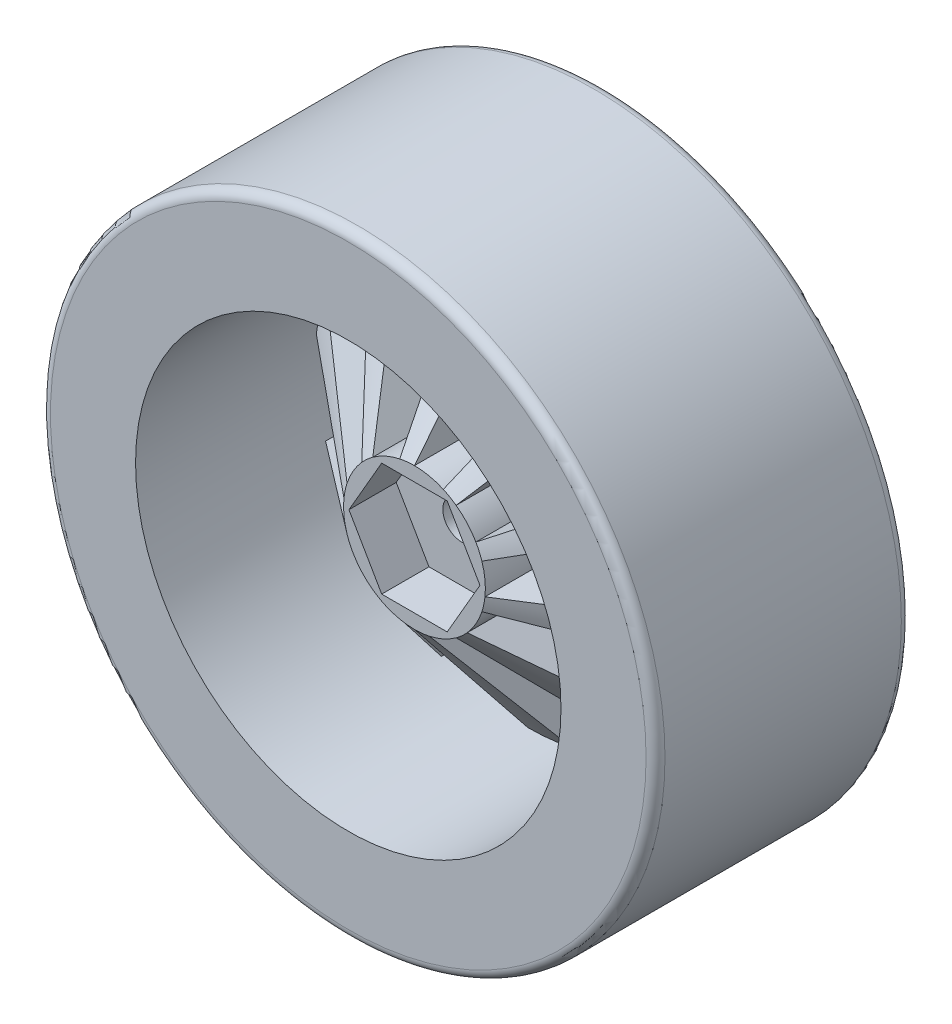
from build123d import *

# Parameters (mm, degrees)
SKETCH_1_R               = 7.5
EXTRUDE_1_DEPTH          = 5
EXTRUDE_START            = -3
SKETCH_2_R               = 7.5
SKETCH_2_R_2             = 2
EXTRUDE_2_DEPTH          = 3
EXTRUDE_3_DEPTH          = 12
EXTRUDE_3_DEPTH_BACK     = 15
SKETCH_3_R               = 32.5
SKETCH_3_R_2             = 22.5
REVOLVE_1_ANGLE          = 12
PATTERN_CIRCULAR_1_COUNT = 10
SKETCH_5_R               = 4.5
CUT_EXTRUDE_1_DEPTH      = 2
FILLET_1_R               = 1


with BuildPart() as part:
    # 草图1 → 凸台-拉伸1 (new body)
    with BuildSketch(Plane.XY):
        Circle(SKETCH_1_R)
        Polygon((-6.92820323, 0), (-3.464101615, -6), (3.464101615, -6), (6.92820323, 0), (3.464101615, 6), (-3.464101615, 6), align=None, mode=Mode.SUBTRACT)
    extrude(amount=EXTRUDE_1_DEPTH)

    # 草图2 → 凸台-拉伸2 (add)
    with BuildSketch(Plane.XY.offset(EXTRUDE_START)):
        Circle(SKETCH_2_R)
        Circle(SKETCH_2_R_2, mode=Mode.SUBTRACT)
    extrude(amount=EXTRUDE_2_DEPTH)



with BuildPart() as body_2:
    # 草图3 → 凸台-拉伸3 (new, two sides: drawn at the far end of the back side and taken through both)
    with BuildSketch(Plane.XY.offset(-EXTRUDE_3_DEPTH_BACK)):
        Circle(SKETCH_3_R)
        Circle(SKETCH_3_R_2, mode=Mode.SUBTRACT)
    extrude(amount=EXTRUDE_3_DEPTH + EXTRUDE_3_DEPTH_BACK)


with BuildPart() as part_1:
    add(part.part)

    add(body_2.part)  # 旋转1 merges body 2
    # 草图4 → 旋转1 (revolve)
    with BuildSketch(Plane(origin=(0, 0, 0), x_dir=(0, 0, -1), z_dir=(1, 0, 0))):
        Polygon((-5, 7.5), (3, 7.5), (15, 22.5), (7, 22.5), align=None)
    revolve_1 = revolve(axis=Axis((0, 0, -16.35), (0, 0, 1)), revolution_arc=REVOLVE_1_ANGLE)

    # 阵列(圆周)1: 旋转1 ×10 about axis
    pattern_circular_1_axis = Axis((0, 0, 0), (0, 0, 1))
    for i in range(1, PATTERN_CIRCULAR_1_COUNT):
        add(revolve_1.rotate(pattern_circular_1_axis, i * 360 / PATTERN_CIRCULAR_1_COUNT))

    # 草图5 → 切除-拉伸1 (cut)
    with BuildSketch(Plane(origin=(0, 0, -3), x_dir=(-1, 0, 0), z_dir=(0, 0, -1))):
        Circle(SKETCH_5_R)
    extrude(amount=-CUT_EXTRUDE_1_DEPTH, mode=Mode.SUBTRACT)

    # 圆角1
    fillet_1_edges = [part_1.edges().sort_by_distance(p)[0] for p in [
        (-32.5, 0, -15),
        (-32.5, 0, 12),
    ]]
    fillet(fillet_1_edges, radius=FILLET_1_R)


solid = part_1.part
